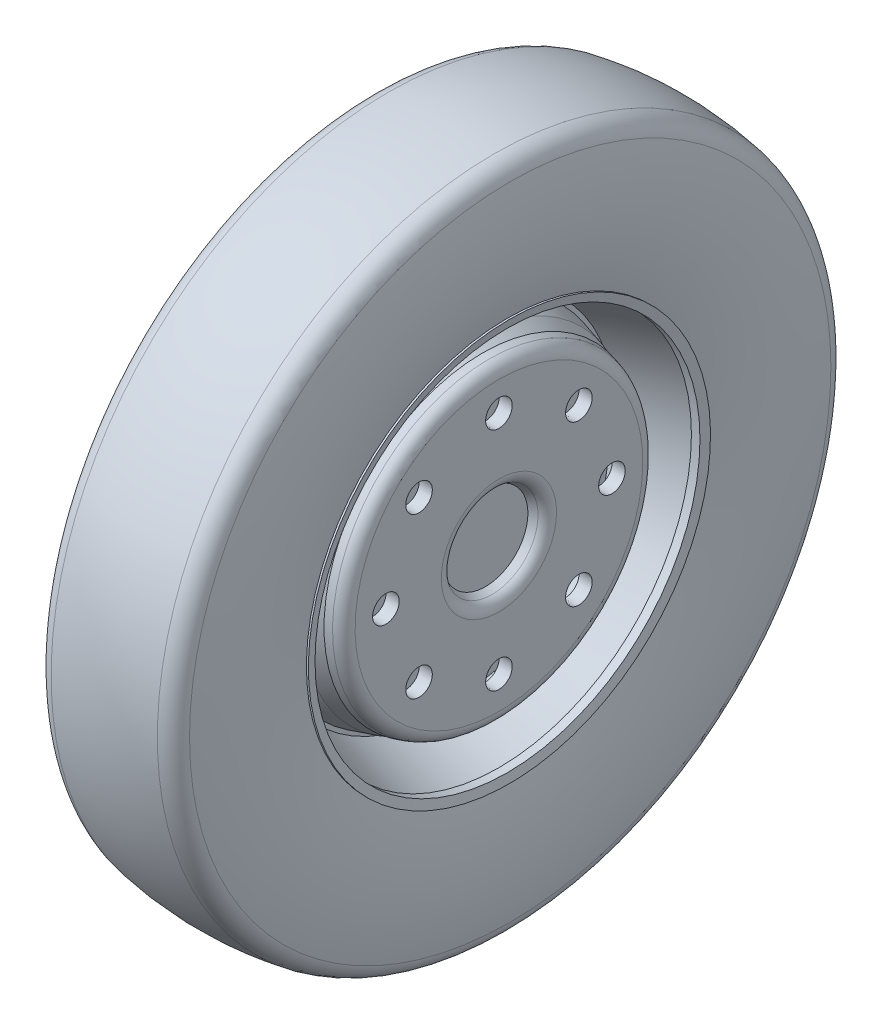
from build123d import *

# Parameters (mm, degrees)
SKETCH3_R                    = 20
CUT_EXTRUDE1_DEPTH           = 50
CUT_EXTRUDE1_DRAFT           = 1
CUT_EXTRUDE1_PROFILE_2_DEPTH = 50
CUT_EXTRUDE1_PROFILE_2_DRAFT = 1
CUT_EXTRUDE1_PROFILE_3_DEPTH = 50
CUT_EXTRUDE1_PROFILE_3_DRAFT = 1
CUT_EXTRUDE1_PROFILE_4_DEPTH = 50
CUT_EXTRUDE1_PROFILE_4_DRAFT = 1
CUT_EXTRUDE1_PROFILE_5_DEPTH = 50
CUT_EXTRUDE1_PROFILE_5_DRAFT = 1
CUT_EXTRUDE1_PROFILE_6_DEPTH = 50
CUT_EXTRUDE1_PROFILE_6_DRAFT = 1
CUT_EXTRUDE1_PROFILE_7_DEPTH = 50
CUT_EXTRUDE1_PROFILE_7_DRAFT = 1
CUT_EXTRUDE1_PROFILE_8_DEPTH = 50
CUT_EXTRUDE1_PROFILE_8_DRAFT = 1
FILLET1_R                    = 20
SKETCH4_R                    = 15
CUT_EXTRUDE2_DEPTH           = 744.198533285


with BuildPart() as part:
    # Sketch2 → Revolve1 (revolve)
    with BuildSketch(Plane.XY):
        with BuildLine():
            Line((0, 300), (0, 212.544114939))
            Line((0, 212.544114939), (25, 212.544114939))
            Line((25, 212.544114939), (25, -2.455885061))
            Line((25, -2.455885061), (46.816823153, -2.455885061))
            Line((46.816823153, -2.455885061), (113.821302455, -2.455885061))
            Line((113.821302455, -2.455885061), (113.821302455, 61.25178063))
            Line((113.821302455, 61.25178063), (133.968825245, 72.379398613))
            Line((133.968825245, 72.379398613), (133.968825245, 229.140257961))
            Line((133.968825245, 229.140257961), (109.266714672, 235.952137163))
            Line((109.266714672, 235.952137163), (109.266714672, 233.403128412))
            Line((109.266714672, 233.403128412), (124.725282579, 229.140257961))
            Line((124.725282579, 229.140257961), (121.3943705, 222.912210895))
            Line((121.3943705, 222.912210895), (83.968825245, 242.928308949))
            Line((83.968825245, 242.928308949), (48.426919774, 252.729381046))
            Line((48.426919774, 252.729381046), (48.426919774, 245.263758119))
            Line((48.426919774, 245.263758119), (46.816823153, 245.263758119))
            Line((46.816823153, 245.263758119), (46.816823153, 259.171948851))
            Line((46.816823153, 259.171948851), (133.968825245, 287.06871555))
            Line((133.968825245, 287.06871555), (146.816823153, 287.06871555))
            Line((146.816823153, 287.06871555), (149.751445643, 300))
            Line((149.751445643, 300), (146.816823153, 300))
            ThreePointArc((146.816823153, 300), (157.951742717, 389.745181475), (150.917639551, 479.904515014))
            ThreePointArc((150.917639551, 479.904515014), (142.607573935, 495.790750782), (126.721338167, 504.100816398))
            ThreePointArc((126.721338167, 504.100816398), (46.816823153, 511.25178063), (-33.087691862, 504.100816398))
            ThreePointArc((-33.087691862, 504.100816398), (-48.97392763, 495.790750782), (-57.283993245, 479.904515014))
            ThreePointArc((-57.283993245, 479.904515014), (-64.428071695, 402.489408933), (-58.14094121, 325))
            ThreePointArc((-58.14094121, 325), (-47.925459025, 307.087121525), (-28.560542294, 300))
            Line((-28.560542294, 300), (0, 300))
        make_face()
        Polygon((113.821302455, 89.47847526), (113.821302455, 205.02090026), (83.968825245, 212.544114939), (83.968825245, 89.47847526), align=None, mode=Mode.SUBTRACT)
    revolve(axis=Axis((113.821302455, -2.455885061, 0), (-1, 0, 0)))


with BuildPart() as cut_extrude1_tool:
    # Sketch3 → Cut-Extrude1 (with draft: the straight prism first)
    with BuildSketch(Plane(origin=(133.968825245, 0, 0), x_dir=(0, 0, -1), z_dir=(1, 0, 0))):
        with Locations((0, 170)):
            Circle(SKETCH3_R)
    extrude(amount=-CUT_EXTRUDE1_DEPTH)
    # Cut-Extrude1: the draft: its side faces are tilted about the plane it starts from
    cut_extrude1_sides = [cut_extrude1_tool.faces().sort_by_distance(p)[0] for p in [
        (108.968825245, 170, 20),
    ]]
    draft(cut_extrude1_sides, Plane(origin=(133.968825245, 0, 0), x_dir=(0, 0, -1), z_dir=(1, 0, 0)), CUT_EXTRUDE1_DRAFT)


with BuildPart() as part_1:
    add(part.part)

    # Cut-Extrude1: cut by cut_extrude1_tool
    add(cut_extrude1_tool.part, mode=Mode.SUBTRACT)


with BuildPart() as cut_extrude1_profile_2_tool:
    # Sketch3 → Cut-Extrude1 profile 2 (with draft: the straight prism first)
    with BuildSketch(Plane(origin=(133.968825245, 0, 0), x_dir=(0, 0, -1), z_dir=(1, 0, 0))):
        with Locations((120.208152802, 120.208152802)):
            Circle(SKETCH3_R)
    extrude(amount=-CUT_EXTRUDE1_PROFILE_2_DEPTH)
    # Cut-Extrude1 profile 2: the draft: its side faces are tilted about the plane it starts from
    cut_extrude1_profile_2_sides = [cut_extrude1_profile_2_tool.faces().sort_by_distance(p)[0] for p in [
        (108.968825245, 120.208152802, -100.208152802),
    ]]
    draft(cut_extrude1_profile_2_sides, Plane(origin=(133.968825245, 0, 0), x_dir=(0, 0, -1), z_dir=(1, 0, 0)), CUT_EXTRUDE1_PROFILE_2_DRAFT)


with BuildPart() as part_2:
    add(part_1.part)

    # Cut-Extrude1 profile 2: cut by cut_extrude1_profile_2_tool
    add(cut_extrude1_profile_2_tool.part, mode=Mode.SUBTRACT)


with BuildPart() as cut_extrude1_profile_3_tool:
    # Sketch3 → Cut-Extrude1 profile 3 (with draft: the straight prism first)
    with BuildSketch(Plane(origin=(133.968825245, 0, 0), x_dir=(0, 0, -1), z_dir=(1, 0, 0))):
        with Locations((170, 0)):
            Circle(SKETCH3_R)
    extrude(amount=-CUT_EXTRUDE1_PROFILE_3_DEPTH)
    # Cut-Extrude1 profile 3: the draft: its side faces are tilted about the plane it starts from
    cut_extrude1_profile_3_sides = [cut_extrude1_profile_3_tool.faces().sort_by_distance(p)[0] for p in [
        (108.968825245, 0, -150),
    ]]
    draft(cut_extrude1_profile_3_sides, Plane(origin=(133.968825245, 0, 0), x_dir=(0, 0, -1), z_dir=(1, 0, 0)), CUT_EXTRUDE1_PROFILE_3_DRAFT)


with BuildPart() as part_3:
    add(part_2.part)

    # Cut-Extrude1 profile 3: cut by cut_extrude1_profile_3_tool
    add(cut_extrude1_profile_3_tool.part, mode=Mode.SUBTRACT)


with BuildPart() as cut_extrude1_profile_4_tool:
    # Sketch3 → Cut-Extrude1 profile 4 (with draft: the straight prism first)
    with BuildSketch(Plane(origin=(133.968825245, 0, 0), x_dir=(0, 0, -1), z_dir=(1, 0, 0))):
        with Locations((120.208152802, -120.208152802)):
            Circle(SKETCH3_R)
    extrude(amount=-CUT_EXTRUDE1_PROFILE_4_DEPTH)
    # Cut-Extrude1 profile 4: the draft: its side faces are tilted about the plane it starts from
    cut_extrude1_profile_4_sides = [cut_extrude1_profile_4_tool.faces().sort_by_distance(p)[0] for p in [
        (108.968825245, -120.208152802, -100.208152802),
    ]]
    draft(cut_extrude1_profile_4_sides, Plane(origin=(133.968825245, 0, 0), x_dir=(0, 0, -1), z_dir=(1, 0, 0)), CUT_EXTRUDE1_PROFILE_4_DRAFT)


with BuildPart() as part_4:
    add(part_3.part)

    # Cut-Extrude1 profile 4: cut by cut_extrude1_profile_4_tool
    add(cut_extrude1_profile_4_tool.part, mode=Mode.SUBTRACT)


with BuildPart() as cut_extrude1_profile_5_tool:
    # Sketch3 → Cut-Extrude1 profile 5 (with draft: the straight prism first)
    with BuildSketch(Plane(origin=(133.968825245, 0, 0), x_dir=(0, 0, -1), z_dir=(1, 0, 0))):
        with Locations((0, -170)):
            Circle(SKETCH3_R)
    extrude(amount=-CUT_EXTRUDE1_PROFILE_5_DEPTH)
    # Cut-Extrude1 profile 5: the draft: its side faces are tilted about the plane it starts from
    cut_extrude1_profile_5_sides = [cut_extrude1_profile_5_tool.faces().sort_by_distance(p)[0] for p in [
        (108.968825245, -170, 20),
    ]]
    draft(cut_extrude1_profile_5_sides, Plane(origin=(133.968825245, 0, 0), x_dir=(0, 0, -1), z_dir=(1, 0, 0)), CUT_EXTRUDE1_PROFILE_5_DRAFT)


with BuildPart() as part_5:
    add(part_4.part)

    # Cut-Extrude1 profile 5: cut by cut_extrude1_profile_5_tool
    add(cut_extrude1_profile_5_tool.part, mode=Mode.SUBTRACT)


with BuildPart() as cut_extrude1_profile_6_tool:
    # Sketch3 → Cut-Extrude1 profile 6 (with draft: the straight prism first)
    with BuildSketch(Plane(origin=(133.968825245, 0, 0), x_dir=(0, 0, -1), z_dir=(1, 0, 0))):
        with Locations((-120.208152802, -120.208152802)):
            Circle(SKETCH3_R)
    extrude(amount=-CUT_EXTRUDE1_PROFILE_6_DEPTH)
    # Cut-Extrude1 profile 6: the draft: its side faces are tilted about the plane it starts from
    cut_extrude1_profile_6_sides = [cut_extrude1_profile_6_tool.faces().sort_by_distance(p)[0] for p in [
        (108.968825245, -120.208152802, 140.208152802),
    ]]
    draft(cut_extrude1_profile_6_sides, Plane(origin=(133.968825245, 0, 0), x_dir=(0, 0, -1), z_dir=(1, 0, 0)), CUT_EXTRUDE1_PROFILE_6_DRAFT)


with BuildPart() as part_6:
    add(part_5.part)

    # Cut-Extrude1 profile 6: cut by cut_extrude1_profile_6_tool
    add(cut_extrude1_profile_6_tool.part, mode=Mode.SUBTRACT)


with BuildPart() as cut_extrude1_profile_7_tool:
    # Sketch3 → Cut-Extrude1 profile 7 (with draft: the straight prism first)
    with BuildSketch(Plane(origin=(133.968825245, 0, 0), x_dir=(0, 0, -1), z_dir=(1, 0, 0))):
        with Locations((-170, 0)):
            Circle(SKETCH3_R)
    extrude(amount=-CUT_EXTRUDE1_PROFILE_7_DEPTH)
    # Cut-Extrude1 profile 7: the draft: its side faces are tilted about the plane it starts from
    cut_extrude1_profile_7_sides = [cut_extrude1_profile_7_tool.faces().sort_by_distance(p)[0] for p in [
        (108.968825245, 0, 190),
    ]]
    draft(cut_extrude1_profile_7_sides, Plane(origin=(133.968825245, 0, 0), x_dir=(0, 0, -1), z_dir=(1, 0, 0)), CUT_EXTRUDE1_PROFILE_7_DRAFT)


with BuildPart() as part_7:
    add(part_6.part)

    # Cut-Extrude1 profile 7: cut by cut_extrude1_profile_7_tool
    add(cut_extrude1_profile_7_tool.part, mode=Mode.SUBTRACT)


with BuildPart() as cut_extrude1_profile_8_tool:
    # Sketch3 → Cut-Extrude1 profile 8 (with draft: the straight prism first)
    with BuildSketch(Plane(origin=(133.968825245, 0, 0), x_dir=(0, 0, -1), z_dir=(1, 0, 0))):
        with Locations((-120.208152802, 120.208152802)):
            Circle(SKETCH3_R)
    extrude(amount=-CUT_EXTRUDE1_PROFILE_8_DEPTH)
    # Cut-Extrude1 profile 8: the draft: its side faces are tilted about the plane it starts from
    cut_extrude1_profile_8_sides = [cut_extrude1_profile_8_tool.faces().sort_by_distance(p)[0] for p in [
        (108.968825245, 120.208152802, 140.208152802),
    ]]
    draft(cut_extrude1_profile_8_sides, Plane(origin=(133.968825245, 0, 0), x_dir=(0, 0, -1), z_dir=(1, 0, 0)), CUT_EXTRUDE1_PROFILE_8_DRAFT)


with BuildPart() as part_8:
    add(part_7.part)

    # Cut-Extrude1 profile 8: cut by cut_extrude1_profile_8_tool
    add(cut_extrude1_profile_8_tool.part, mode=Mode.SUBTRACT)

    # Fillet1
    fillet1_edges = [part_8.edges().sort_by_distance(p)[0] for p in [
        (133.968825245, -77.291168734, 0),
        (133.968825245, -234.052028083, 0),
    ]]
    fillet(fillet1_edges, radius=FILLET1_R)

    # Sketch4 → Cut-Extrude2 (cut, through all)
    with BuildSketch(Plane(origin=(83.968825245, 0, 0), x_dir=(0, 0, -1), z_dir=(1, 0, 0))):
        with Locations((0, 170)):
            Circle(SKETCH4_R)
        with Locations((120.208152802, 120.208152802)):
            Circle(SKETCH4_R)
        with Locations((170, 0)):
            Circle(SKETCH4_R)
        with Locations((120.208152802, -120.208152802)):
            Circle(SKETCH4_R)
        with Locations((0, -170)):
            Circle(SKETCH4_R)
        with Locations((-120.208152802, -120.208152802)):
            Circle(SKETCH4_R)
        with Locations((-170, 0)):
            Circle(SKETCH4_R)
        with Locations((-120.208152802, 120.208152802)):
            Circle(SKETCH4_R)
    extrude(amount=-CUT_EXTRUDE2_DEPTH, mode=Mode.SUBTRACT)


solid = part_8.part
